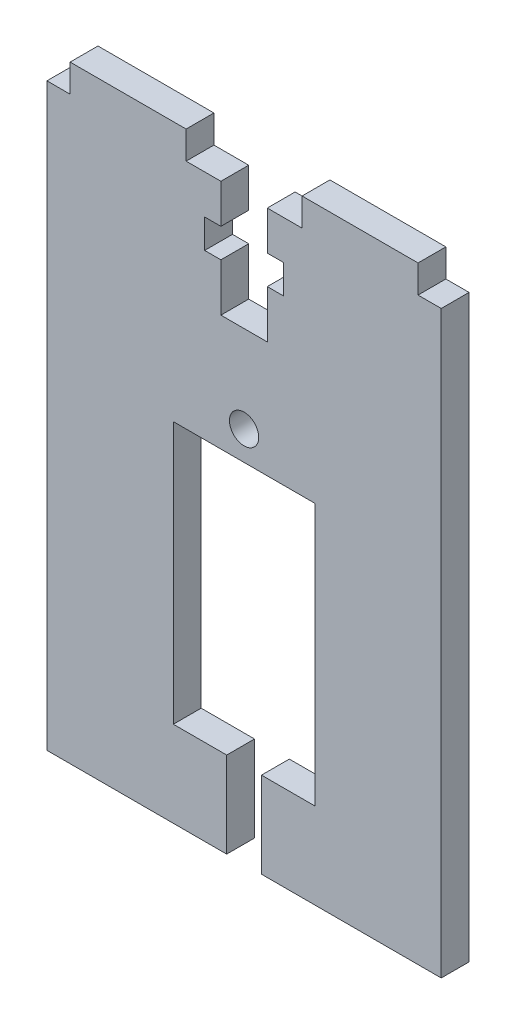
from build123d import *

# Parameters (mm, degrees)
SKETCH1_R           = 1.262505146
BOSS_EXTRUDE1_DEPTH = 2.4


with BuildPart() as part:
    # Sketch1 → Boss-Extrude1 (new body)
    with BuildSketch(Plane.XY):
        Polygon((17, 25.571584313), (15, 25.571584313), (15, 27.971584313), (5, 27.971584313), (5, 25.571584313), (2, 25.571584313), (2, 22.204806168), (3.4, 22.204806168), (3.4, 19.704806168), (2, 19.704806168), (2, 15.571584313), (-2, 15.571584313), (-2, 19.704806168), (-3.4, 19.704806168), (-3.4, 22.204806168), (-2, 22.204806168), (-2, 25.571584313), (-5, 25.571584313), (-5, 27.971584313), (-15, 27.971584313), (-15, 25.571584313), (-17, 25.571584313), (-17, -24.428415687), (-1.5, -24.428415687), (-1.5, -17.028415687), (-6.1, -17.028415687), (-6.1, 5.571584313), (0, 5.571584313), (6.1, 5.571584313), (6.1, -17.028415687), (1.5, -17.028415687), (1.5, -24.428415687), (17, -24.428415687), align=None)
        with Locations((0, 8.071584313)):
            Circle(SKETCH1_R, mode=Mode.SUBTRACT)
    extrude(amount=BOSS_EXTRUDE1_DEPTH)


solid = part.part
